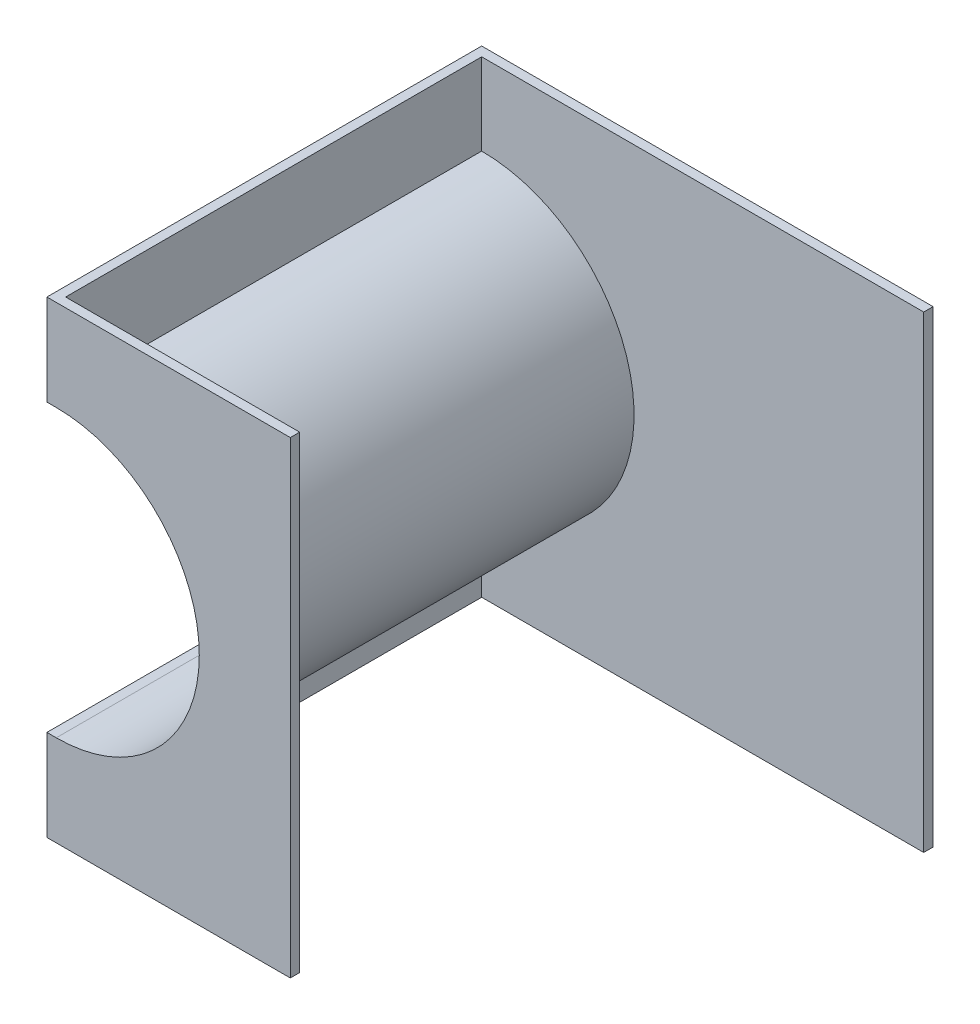
from build123d import *

# Parameters (mm, degrees)
P_IDAT_VYSUNUT_M1_DEPTH = 0.4
P_IDAT_START            = 0.018
P_IDAT_VYSUNUT_M2_DEPTH = 0.018
P_IDAT_VYSUNUT_M3_DEPTH = 0.018


with BuildPart() as part:
    # Skica1 → Přidat vysunutím1 (new, symmetric)
    with BuildSketch(Plane.XY):
        with BuildLine():
            Line((0, 0.275), (-0.018, 0.275))
            Line((-0.018, 0.275), (-0.018, 0.45))
            Line((-0.018, 0.45), (0, 0.45))
            Line((0, 0.45), (0, 0.293))
            ThreePointArc((0, 0.293), (0.293, 0), (0, -0.293))
            Line((0, -0.293), (0, -0.45))
            Line((0, -0.45), (-0.018, -0.45))
            Line((-0.018, -0.45), (-0.018, -0.275))
            Line((-0.018, -0.275), (0, -0.275))
            ThreePointArc((0, -0.275), (0.275, 0), (0, 0.275))
        make_face()
    extrude(amount=P_IDAT_VYSUNUT_M1_DEPTH, both=True)

    # Skica2 → Přidat vysunutím2 (add)
    with BuildSketch(Plane.XY.offset(0.4).offset(P_IDAT_START)):
        with BuildLine():
            Line((0, 0.45), (0.45, 0.45))
            Line((0.45, 0.45), (0.45, -0.45))
            Line((0.45, -0.45), (0, -0.45))
            Line((0, -0.45), (-0.018, -0.45))
            Line((-0.018, -0.45), (-0.018, -0.275))
            Line((-0.018, -0.275), (0, -0.275))
            ThreePointArc((0, -0.275), (0.275, 0), (0, 0.275))
            Line((0, 0.275), (-0.018, 0.275))
            Line((-0.018, 0.275), (-0.018, 0.45))
            Line((-0.018, 0.45), (0, 0.45))
        make_face()
    extrude(amount=-P_IDAT_VYSUNUT_M2_DEPTH)

    # Skica3 → Přidat vysunutím3 (add)
    with BuildSketch(Plane(origin=(0, 0, -0.4), x_dir=(-1, 0, 0), z_dir=(0, 0, -1))):
        with BuildLine():
            Line((0, 0.45), (-0.85, 0.45))
            Line((-0.85, 0.45), (-0.85, -0.45))
            Line((-0.85, -0.45), (0, -0.45))
            Line((0, -0.45), (0.018, -0.45))
            Line((0.018, -0.45), (0.018, -0.275))
            Line((0.018, -0.275), (0, -0.275))
            ThreePointArc((0, -0.275), (-0.275, 0), (0, 0.275))
            Line((0, 0.275), (0.018, 0.275))
            Line((0.018, 0.275), (0.018, 0.45))
            Line((0.018, 0.45), (0, 0.45))
        make_face()
    extrude(amount=P_IDAT_VYSUNUT_M3_DEPTH)


solid = part.part
